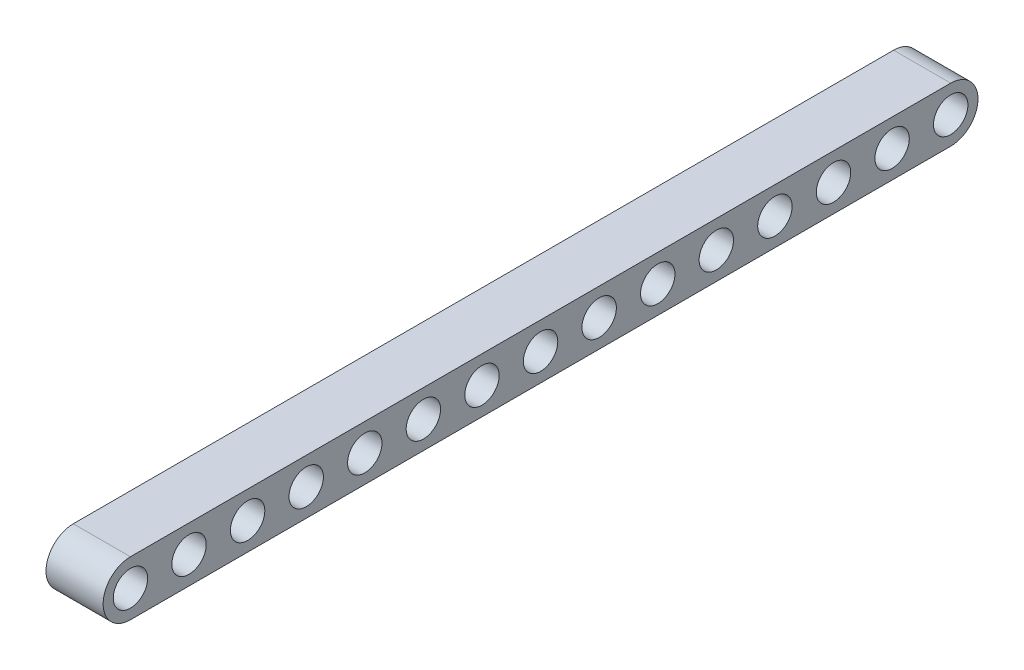
from build123d import *

# Parameters (mm, degrees)
SKETCH1_R           = 2.35
BOSS_EXTRUDE1_DEPTH = 7.8


with BuildPart() as part:
    # Sketch1 → Boss-Extrude1 (new body)
    with BuildSketch(Plane(origin=(0, 0, 0), x_dir=(0, 0, -1), z_dir=(1, 0, 0))):
        with BuildLine():
            Line((-56, -3.73), (56, -3.73))
            ThreePointArc((56, -3.73), (59.73, 0), (56, 3.73))
            Line((56, 3.73), (-56, 3.73))
            ThreePointArc((-56, 3.73), (-59.73, 0), (-56, -3.73))
        make_face()
        with Locations((-56, 0)):
            Circle(SKETCH1_R, mode=Mode.SUBTRACT)
        with Locations((-48, 0)):
            Circle(SKETCH1_R, mode=Mode.SUBTRACT)
        with Locations((-40, 0)):
            Circle(SKETCH1_R, mode=Mode.SUBTRACT)
        with Locations((-32, 0)):
            Circle(SKETCH1_R, mode=Mode.SUBTRACT)
        with Locations((-24, 0)):
            Circle(SKETCH1_R, mode=Mode.SUBTRACT)
        with Locations((-16, 0)):
            Circle(SKETCH1_R, mode=Mode.SUBTRACT)
        with Locations((-8, 0)):
            Circle(SKETCH1_R, mode=Mode.SUBTRACT)
        Circle(SKETCH1_R, mode=Mode.SUBTRACT)
        with Locations((8, 0)):
            Circle(SKETCH1_R, mode=Mode.SUBTRACT)
        with Locations((16, 0)):
            Circle(SKETCH1_R, mode=Mode.SUBTRACT)
        with Locations((24, 0)):
            Circle(SKETCH1_R, mode=Mode.SUBTRACT)
        with Locations((32, 0)):
            Circle(SKETCH1_R, mode=Mode.SUBTRACT)
        with Locations((40, 0)):
            Circle(SKETCH1_R, mode=Mode.SUBTRACT)
        with Locations((48, 0)):
            Circle(SKETCH1_R, mode=Mode.SUBTRACT)
        with Locations((56, 0)):
            Circle(SKETCH1_R, mode=Mode.SUBTRACT)
    extrude(amount=BOSS_EXTRUDE1_DEPTH)


solid = part.part
